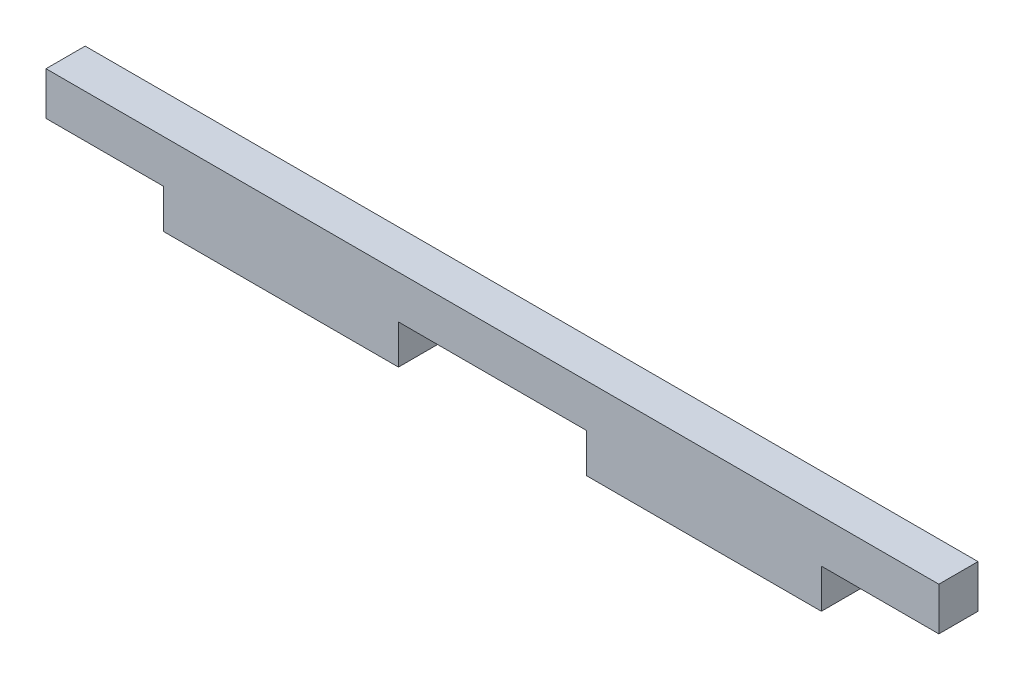
from build123d import *

# Parameters (mm, degrees)
SKETCH_1_W      = 114
SKETCH_1_H      = 5.5
SKETCH_1_W_2    = 30
SKETCH_1_H_2    = 5
EXTRUDE_1_DEPTH = 5


with BuildPart() as part:
    # 草图1 → 凸台-拉伸1 (new body)
    with BuildSketch(Plane.XY):
        with Locations((-57, 2.75)):
            Rectangle(SKETCH_1_W, SKETCH_1_H)
        with Locations((-84, -2.5)):
            Rectangle(SKETCH_1_W_2, SKETCH_1_H_2)
        with Locations((-30, -2.5)):
            Rectangle(SKETCH_1_W_2, SKETCH_1_H_2)
    extrude(amount=EXTRUDE_1_DEPTH)


solid = part.part
